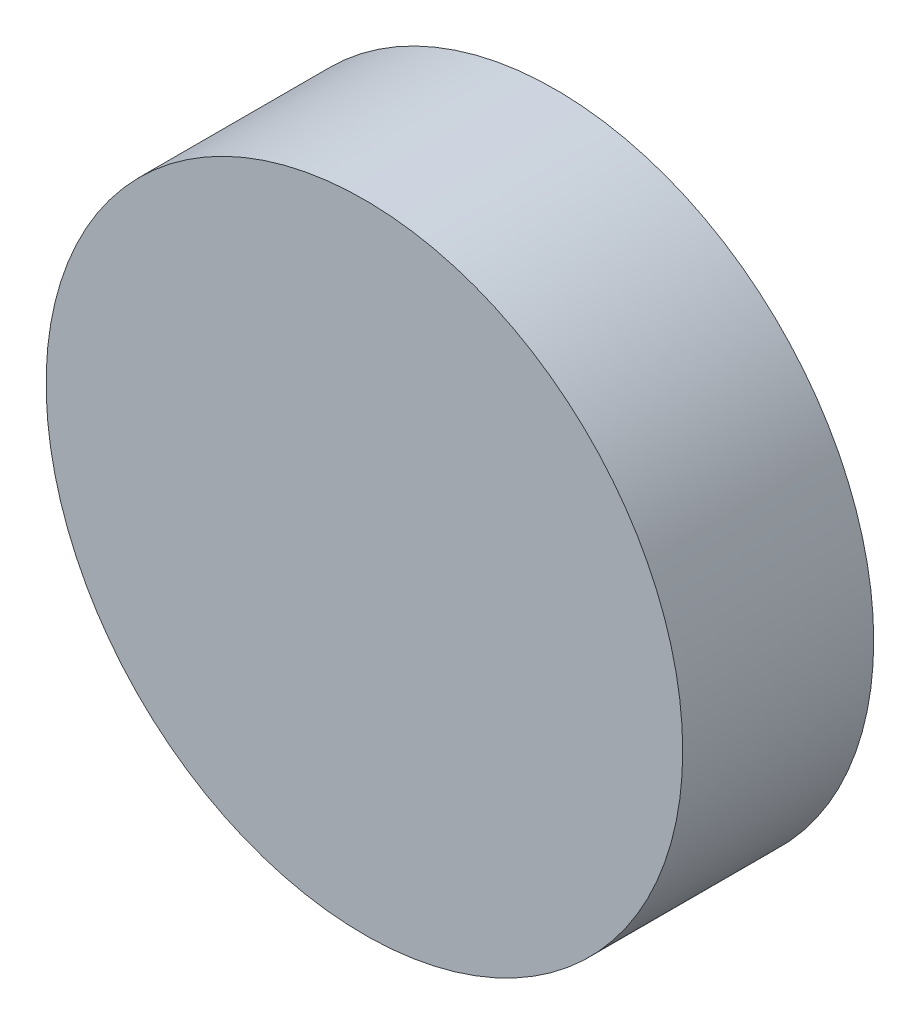
from build123d import *

# Parameters (mm, degrees)
SKETCH_1_R      = 25
EXTRUDE_1_DEPTH = 7.5


with BuildPart() as part:
    # 草图1 → 凸台-拉伸1 (new, symmetric)
    with BuildSketch(Plane.XY):
        Circle(SKETCH_1_R)
    extrude(amount=EXTRUDE_1_DEPTH, both=True)


solid = part.part
